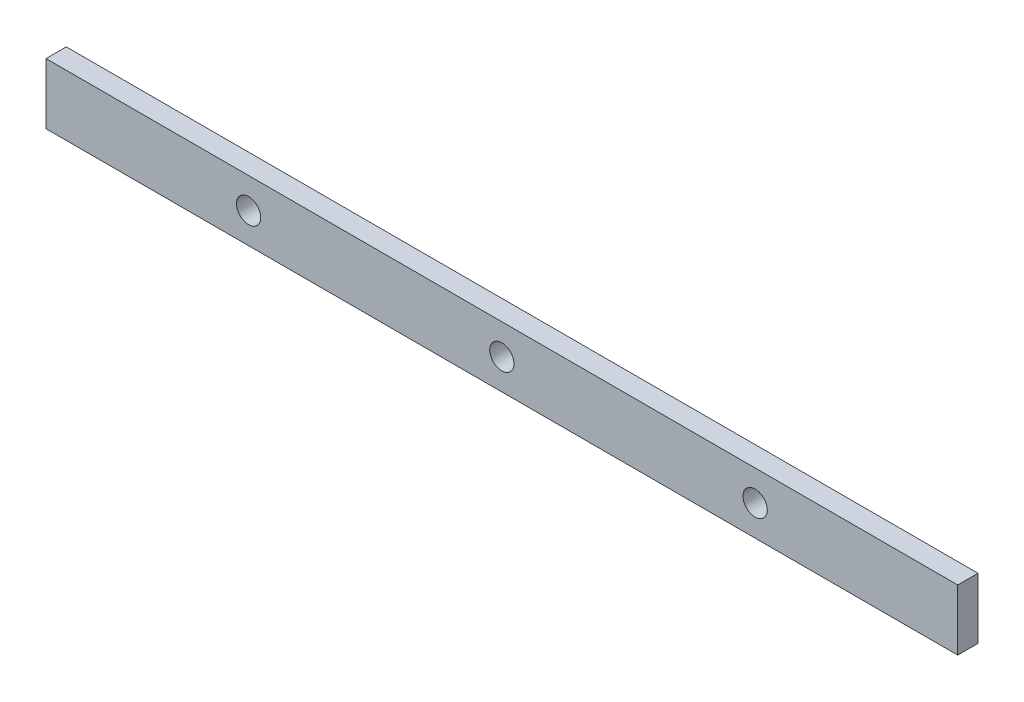
from build123d import *

# Parameters (mm, degrees)
ESBO_O1_W                = 450
ESBO_O1_H                = 30
RESSALTO_EXTRUS_O1_DEPTH = 10
ESBO_O2_R                = 6
CORTE_EXTRUS_O1_DEPTH    = 452.109742746


with BuildPart() as part:
    # Esboço1 → Ressalto-extrusão1 (new body)
    with BuildSketch(Plane.XY):
        with Locations((225, 15)):
            Rectangle(ESBO_O1_W, ESBO_O1_H)
    extrude(amount=RESSALTO_EXTRUS_O1_DEPTH)

    # Esboço2 → Corte-extrusão1 (cut, through all)
    with BuildSketch(Plane.XY.offset(10)):
        with Locations((225, 15)):
            Circle(ESBO_O2_R)
        with Locations((350, 15)):
            Circle(ESBO_O2_R)
        with Locations(Location((100, 15, 0), (0, 0, 180))):
            Circle(ESBO_O2_R)
    extrude(amount=-CORTE_EXTRUS_O1_DEPTH, mode=Mode.SUBTRACT)


solid = part.part
